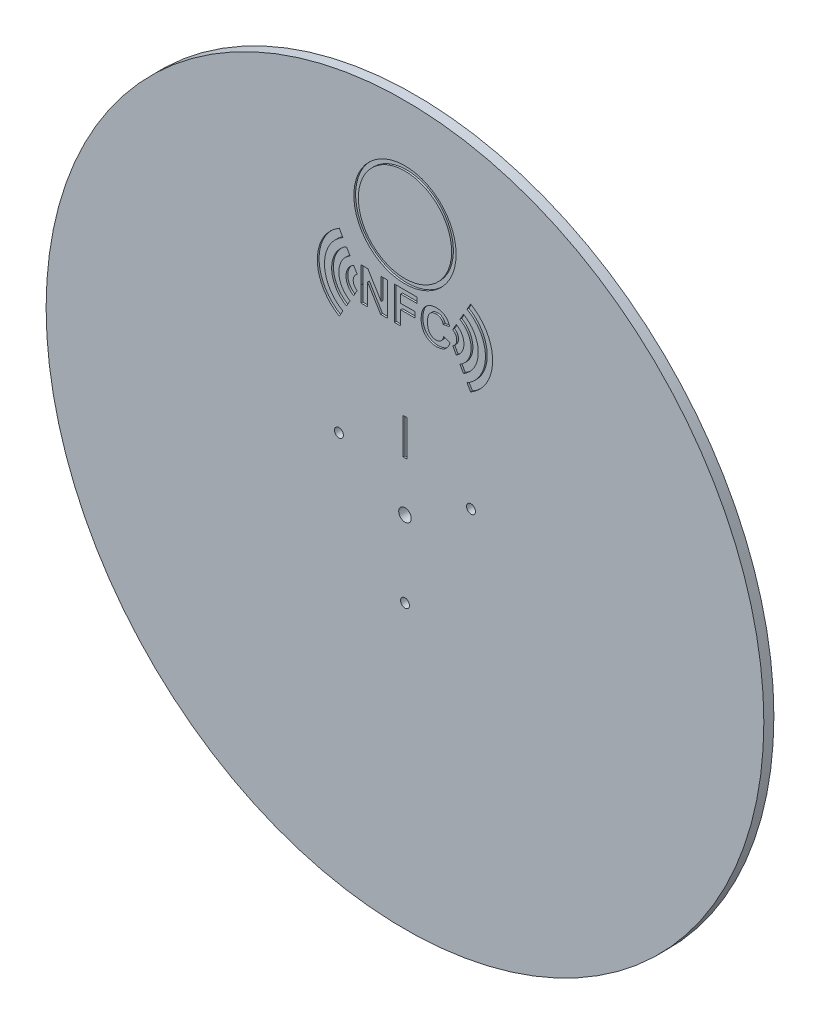
from build123d import *

# Parameters (mm, degrees)
SKETCH1_R           = 100
SKETCH1_R_2         = 12.6
SKETCH1_R_3         = 1.75
BOSS_EXTRUDE1_DEPTH = 1.2
SKETCH2_R           = 100
SKETCH2_R_2         = 1.75
BOSS_EXTRUDE2_DEPTH = 0.8
SKETCH3_R           = 14.25
SKETCH3_R_2         = 13
CUT_EXTRUDE1_DEPTH  = 0.5
BOSS_EXTRUDE3_START = 0.8
SKETCH4_R           = 100
SKETCH4_R_2         = 1.75
BOSS_EXTRUDE3_DEPTH = 0.8
SKETCH5_R           = 1.25
SKETCH5_W           = 1
SKETCH5_H           = 10
CUT_EXTRUDE2_DEPTH  = 2.8
SKETCH6_W           = 1
SKETCH6_H           = 10
BOSS_EXTRUDE4_DEPTH = 2.3


with BuildPart() as part:
    # Sketch1 → Boss-Extrude1 (new body)
    with BuildSketch(Plane.XY):
        Circle(SKETCH1_R)
        with Locations((0, 70)):
            Circle(SKETCH1_R_2, mode=Mode.SUBTRACT)
        Circle(SKETCH1_R_3, mode=Mode.SUBTRACT)
    extrude(amount=BOSS_EXTRUDE1_DEPTH)

    # Sketch2 → Boss-Extrude2 (add)
    with BuildSketch(Plane.XY.offset(1.2)):
        Circle(SKETCH2_R)
        Circle(SKETCH2_R_2, mode=Mode.SUBTRACT)
    extrude(amount=BOSS_EXTRUDE2_DEPTH)

    # Sketch3 → Cut-Extrude1 (cut)
    # profile 1 of 10: a face of its own
    with BuildSketch(Plane.XY.offset(2)):
        with BuildLine():
            Line((-14.304598289, 45.736382), (-13.304598289, 47.468432807))
            ThreePointArc((-13.304598289, 47.468432807), (-14.429598289, 49.416989966), (-13.304598289, 51.365547124))
            Line((-13.304598289, 51.365547124), (-14.304598289, 53.097597932))
            ThreePointArc((-14.304598289, 53.097597932), (-16.429598289, 49.416989966), (-14.304598289, 45.736382))
        make_face()
    # profile 2 of 10: a face of its own
    with BuildSketch(Plane.XY.offset(2)):
        Polygon((-12.179598289, 49.416989966), (-12.209391902, 49.365385915), (-12.209391902, 45), (-10.43132512, 45), (-10.43132512, 50.98245386), (-6.7751753, 45), (-4.860049204, 45), (-4.860049204, 54.245947266), (-6.638115986, 54.245947266), (-6.638115986, 48.167181455), (-10.351682546, 54.245947266), (-12.209391902, 54.245947266), (-12.209391902, 49.468594016), align=None)
    # profile 3 of 10: a face of its own
    with BuildSketch(Plane.XY.offset(2)):
        with BuildLine():
            Line((-16.304598289, 42.272280384), (-15.304598289, 44.004331192))
            ThreePointArc((-15.304598289, 44.004331192), (-18.429598289, 49.416989966), (-15.304598289, 54.829648739))
            Line((-15.304598289, 54.829648739), (-16.304598289, 56.561699547))
            ThreePointArc((-16.304598289, 56.561699547), (-20.429598289, 49.416989966), (-16.304598289, 42.272280384))
        make_face()
    # profile 4 of 10: a face of its own
    with BuildSketch(Plane.XY.offset(2)):
        with BuildLine():
            Line((-18.304598289, 38.808178769), (-17.304598289, 40.540229577))
            ThreePointArc((-17.304598289, 40.540229577), (-22.429598289, 49.416989966), (-17.304598289, 58.293750354))
            Line((-17.304598289, 58.293750354), (-18.304598289, 60.025801162))
            ThreePointArc((-18.304598289, 60.025801162), (-24.429598289, 49.416989966), (-18.304598289, 38.808178769))
        make_face()
    # profile 5 of 10: a face of its own
    with BuildSketch(Plane.XY.offset(2)):
        with BuildLine():
            ThreePointArc((13.304598289, 51.365547124), (14.429598289, 49.416989966), (13.304598289, 47.468432807))
            Line((13.304598289, 47.468432807), (14.304598289, 45.736382))
            ThreePointArc((14.304598289, 45.736382), (16.429598289, 49.416989966), (14.304598289, 53.097597932))
            Line((14.304598289, 53.097597932), (13.304598289, 51.365547124))
        make_face()
    # profile 6 of 10: a face of its own
    with BuildSketch(Plane.XY.offset(2)):
        with BuildLine():
            ThreePointArc((15.304598289, 54.829648739), (18.429598289, 49.416989966), (15.304598289, 44.004331192))
            Line((15.304598289, 44.004331192), (16.304598289, 42.272280384))
            ThreePointArc((16.304598289, 42.272280384), (20.429598289, 49.416989966), (16.304598289, 56.561699547))
            Line((16.304598289, 56.561699547), (15.304598289, 54.829648739))
        make_face()
    # profile 7 of 10: a face of its own
    with BuildSketch(Plane.XY.offset(2)):
        with BuildLine():
            ThreePointArc((17.304598289, 58.293750354), (22.429598289, 49.416989966), (17.304598289, 40.540229577))
            Line((17.304598289, 40.540229577), (18.304598289, 38.808178769))
            ThreePointArc((18.304598289, 38.808178769), (24.429598289, 49.416989966), (18.304598289, 60.025801162))
            Line((18.304598289, 60.025801162), (17.304598289, 58.293750354))
        make_face()
    # profile 8 of 10: a face of its own
    with BuildSketch(Plane.XY.offset(2)):
        Polygon((-2.963444636, 54.245947266), (-2.963444636, 45), (-1.185377855, 45), (-1.185377855, 48.91174692), (2.726369066, 48.91174692), (2.726369066, 50.452738131), (-1.185377855, 50.452738131), (-1.185377855, 52.704956055), (3.319057993, 52.704956055), (3.319057993, 54.245947266), align=None)
    # profile 9 of 10: a face of its own
    with BuildSketch(Plane.XY.offset(2)):
        with BuildLine():
            Line((12.565005258, 47.844906851), (10.786938477, 48.437595778))
            add(Edge.make_bspline(
                [(8.649554033, 46.540991211), (8.774457906, 46.542804078), (8.960902987, 46.552124821), (9.200761468, 46.603342992), (9.371697205, 46.653314203), (9.536735909, 46.716051803), (9.693353441, 46.796521205), (9.844632955, 46.889011376), (9.987435142, 46.997402051), (10.123671935, 47.119091548), (10.24792915, 47.259733892), (10.363183369, 47.415951417), (10.467995906, 47.588781763), (10.565774579, 47.776770817), (10.680063587, 48.058750047), (10.75051939, 48.282015418), (10.786938477, 48.437595778)],
                knots=[0, 0, 0, 0, 0.12046088, 0.178740623, 0.235724111, 0.291792154, 0.348405626, 0.404978529, 0.462271107, 0.520759571, 0.580529381, 0.642578218, 0.707405436, 0.774920301, 0.846330275, 1, 1, 1, 1], degree=3))
            add(Edge.make_bspline(
                [(6.282502629, 49.737807112), (6.285322977, 49.470306981), (6.297610529, 49.082539498), (6.369602887, 48.589695915), (6.440666935, 48.264864831), (6.532669328, 47.970595781), (6.645226739, 47.70740396), (6.779038197, 47.474979778), (6.933893175, 47.273478116), (7.10587723, 47.100389393), (7.290332212, 46.951570368), (7.486169728, 46.82433845), (7.694568912, 46.719631559), (7.916319835, 46.640528882), (8.233117363, 46.562073655), (8.481308806, 46.539908407), (8.649554033, 46.540991211)],
                knots=[0, 0, 0, 0, 0.177656206, 0.256732639, 0.330177257, 0.398062973, 0.460994883, 0.519731382, 0.575527448, 0.629114465, 0.681254032, 0.732497652, 0.783792002, 0.835623311, 0.888378762, 1, 1, 1, 1], degree=3))
            add(Edge.make_bspline(
                [(8.66066695, 52.82349384), (8.491465901, 52.826075047), (8.242559674, 52.799846285), (7.922640611, 52.727085572), (7.699736188, 52.646106315), (7.49074803, 52.54236084), (7.293294797, 52.416290582), (7.108461861, 52.268387934), (6.93618627, 52.096913588), (6.781592493, 51.898763678), (6.645681991, 51.673529995), (6.532934048, 51.418655469), (6.441392441, 51.136639915), (6.369372519, 50.826818405), (6.298040133, 50.35919413), (6.285308784, 49.991144174), (6.282502629, 49.737807112)],
                knots=[0, 0, 0, 0, 0.114442147, 0.169048205, 0.221995274, 0.274768432, 0.326888881, 0.380476958, 0.434920839, 0.491256742, 0.550390474, 0.612762372, 0.679720015, 0.751074463, 0.828128845, 1, 1, 1, 1], degree=3))
            add(Edge.make_bspline(
                [(10.668400691, 51.282502629), (10.641238914, 51.398054972), (10.587850378, 51.565642196), (10.494156792, 51.777398501), (10.408574753, 51.921779276), (10.317598271, 52.060296222), (10.209906332, 52.186819303), (10.09235562, 52.304658865), (9.964105005, 52.412593655), (9.82668186, 52.508441667), (9.682732574, 52.594604872), (9.529640338, 52.664934387), (9.369443041, 52.721855687), (9.202773529, 52.769483738), (8.965989688, 52.809862605), (8.784209014, 52.826424315), (8.66066695, 52.82349384)],
                knots=[0, 0, 0, 0, 0.129415079, 0.191523435, 0.252186483, 0.312349991, 0.372123769, 0.433096486, 0.493819352, 0.554747395, 0.615749876, 0.676633212, 0.738216912, 0.801141922, 0.865493176, 1, 1, 1, 1], degree=3))
            Line((10.668400691, 51.282502629), (12.446467473, 51.638115986))
            add(Edge.make_bspline(
                [(11.51113026, 53.353209569), (11.618919371, 53.252134624), (11.765446177, 53.081421549), (11.939181695, 52.831726814), (12.062269606, 52.625570238), (12.171970389, 52.4010392), (12.311226739, 52.074446139), (12.396954988, 51.816309851), (12.446467473, 51.638115986)],
                knots=[0, 0, 0, 0, 0.223922581, 0.340367194, 0.461366928, 0.58791332, 0.71930972, 1, 1, 1, 1], degree=3))
            add(Edge.make_bspline(
                [(8.784761194, 54.364485051), (9.05213035, 54.36170592), (9.447480124, 54.337725331), (9.952714034, 54.227961891), (10.305824473, 54.11948993), (10.638318496, 53.976085526), (11.056637945, 53.742604246), (11.338718425, 53.518758054), (11.51113026, 53.353209569)],
                knots=[0, 0, 0, 0, 0.269221899, 0.396222126, 0.519140292, 0.640111566, 0.759624432, 1, 1, 1, 1], degree=3))
            add(Edge.make_bspline(
                [(4.504435847, 49.602599951), (4.503806189, 49.95935967), (4.53809244, 50.480966902), (4.660090028, 51.150009144), (4.790227099, 51.606032572), (4.954122369, 52.032375199), (5.160126736, 52.424803313), (5.398535284, 52.788549361), (5.675745533, 53.116946458), (5.983655723, 53.408518035), (6.31361956, 53.666348484), (6.66871472, 53.882641187), (7.047001045, 54.059546034), (7.448974215, 54.196322464), (8.026435231, 54.330802367), (8.478762466, 54.361874395), (8.784761194, 54.364485051)],
                knots=[0, 0, 0, 0, 0.147853475, 0.216062561, 0.281513739, 0.344147287, 0.405039848, 0.464871931, 0.524079073, 0.582724997, 0.640361728, 0.697328761, 0.754684166, 0.813113061, 0.873014604, 1, 1, 1, 1], degree=3))
            add(Edge.make_bspline(
                [(8.721787996, 45), (8.426367251, 44.997988178), (7.990266773, 45.035933953), (7.432039385, 45.166823587), (7.03995053, 45.29954369), (6.670218657, 45.47557439), (6.319473407, 45.687433116), (5.990266678, 45.939486093), (5.683753354, 46.22746781), (5.405279268, 46.5491846), (5.164468655, 46.902896762), (4.958714021, 47.283621418), (4.792375452, 47.693174913), (4.662454179, 48.131132452), (4.537348729, 48.767470915), (4.504184947, 49.264405834), (4.504435847, 49.602599951)],
                knots=[0, 0, 0, 0, 0.126018891, 0.185824822, 0.244304364, 0.302279211, 0.360195978, 0.418835489, 0.47884239, 0.539358251, 0.600002403, 0.661054814, 0.723669356, 0.788261327, 0.855679185, 1, 1, 1, 1], degree=3))
            add(Edge.make_bspline(
                [(12.565005258, 47.844906851), (12.497380357, 47.615920501), (12.382150303, 47.28238474), (12.179541249, 46.869560595), (12.017716763, 46.586721298), (11.832453107, 46.331624647), (11.634211253, 46.095805011), (11.41707355, 45.884234212), (11.182117383, 45.696459001), (10.931602763, 45.530405863), (10.662620144, 45.390024222), (10.379183478, 45.269124387), (10.078419057, 45.171142401), (9.76232112, 45.0927817), (9.309084503, 45.021757353), (8.959586718, 44.99891792), (8.721787996, 45)],
                knots=[0, 0, 0, 0, 0.137894803, 0.202902916, 0.265167572, 0.325674736, 0.3845661, 0.442763708, 0.500294498, 0.557901352, 0.615910004, 0.675133413, 0.735519841, 0.79825159, 0.862854286, 1, 1, 1, 1], degree=3))
        make_face()
    # profile 10 of 10: a face of its own
    with BuildSketch(Plane.XY.offset(2)):
        with Locations((0, 70)):
            Circle(SKETCH3_R)
        with Locations((0, 70)):
            Circle(SKETCH3_R_2, mode=Mode.SUBTRACT)
    extrude(amount=-CUT_EXTRUDE1_DEPTH, mode=Mode.SUBTRACT)

    # Sketch4 → Boss-Extrude3 (add)
    with BuildSketch(Plane(origin=(0, 0, 0), x_dir=(-1, 0, 0), z_dir=(0, 0, -1)).offset(BOSS_EXTRUDE3_START)):
        Circle(SKETCH4_R)
        Circle(SKETCH4_R_2, mode=Mode.SUBTRACT)
    extrude(amount=-BOSS_EXTRUDE3_DEPTH)

    # Sketch5 → Cut-Extrude2 (cut)
    with BuildSketch(Plane.XY.offset(2)):
        with Locations((0, -21.25)):
            Circle(SKETCH5_R)
        with Locations((-18.40303983, 10.625)):
            Circle(SKETCH5_R)
        with Locations((18.40303983, 10.625)):
            Circle(SKETCH5_R)
        with Locations((0, 18.75)):
            Rectangle(SKETCH5_W, SKETCH5_H)
    extrude(amount=-CUT_EXTRUDE2_DEPTH, mode=Mode.SUBTRACT)

    # Sketch6 → Boss-Extrude4 (add)
    with BuildSketch(Plane(origin=(0, 0, -0.8), x_dir=(-1, 0, 0), z_dir=(0, 0, -1))):
        with Locations((0, 18.75)):
            Rectangle(SKETCH6_W, SKETCH6_H)
    extrude(amount=-BOSS_EXTRUDE4_DEPTH)


solid = part.part
